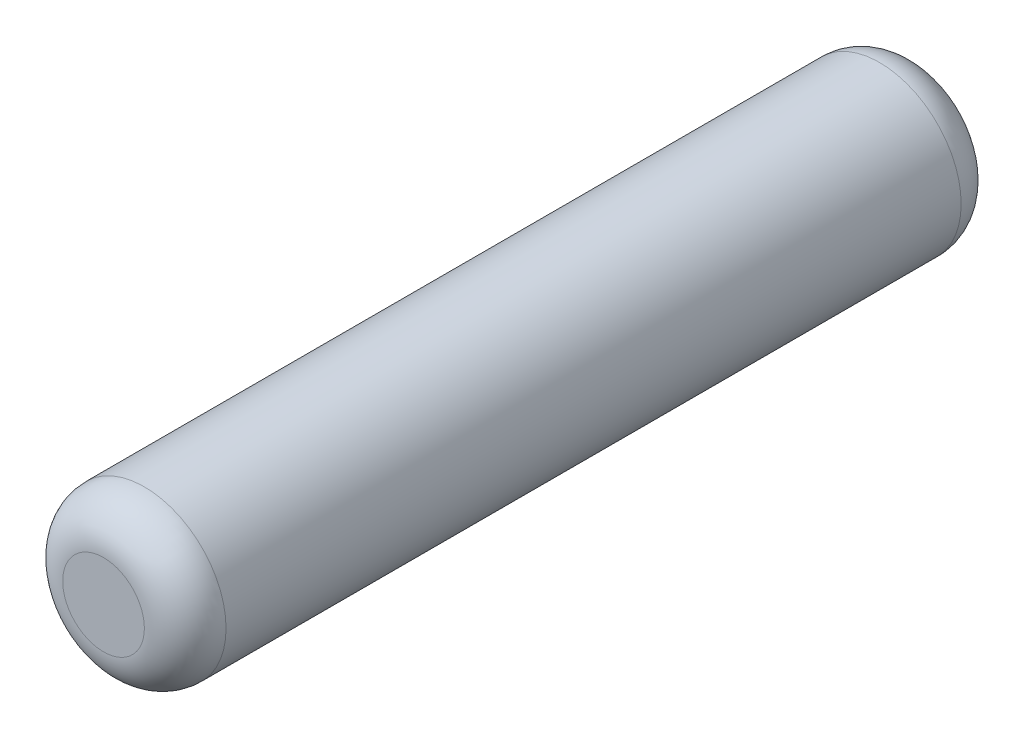
from build123d import *

# Parameters (mm, degrees)
ESQUISSE1_R = 2
AXE_DEPTH   = 20
CONG_R      = 1


with BuildPart() as part:
    # Esquisse1 → axe (new body)
    with BuildSketch(Plane.XY):
        Circle(ESQUISSE1_R)
    extrude(amount=AXE_DEPTH)

    # Cong
    cong_edges = [part.edges().sort_by_distance(p)[0] for p in [
        (-2, 0, 0),
        (-2, 0, 20),
    ]]
    fillet(cong_edges, radius=CONG_R)


solid = part.part
